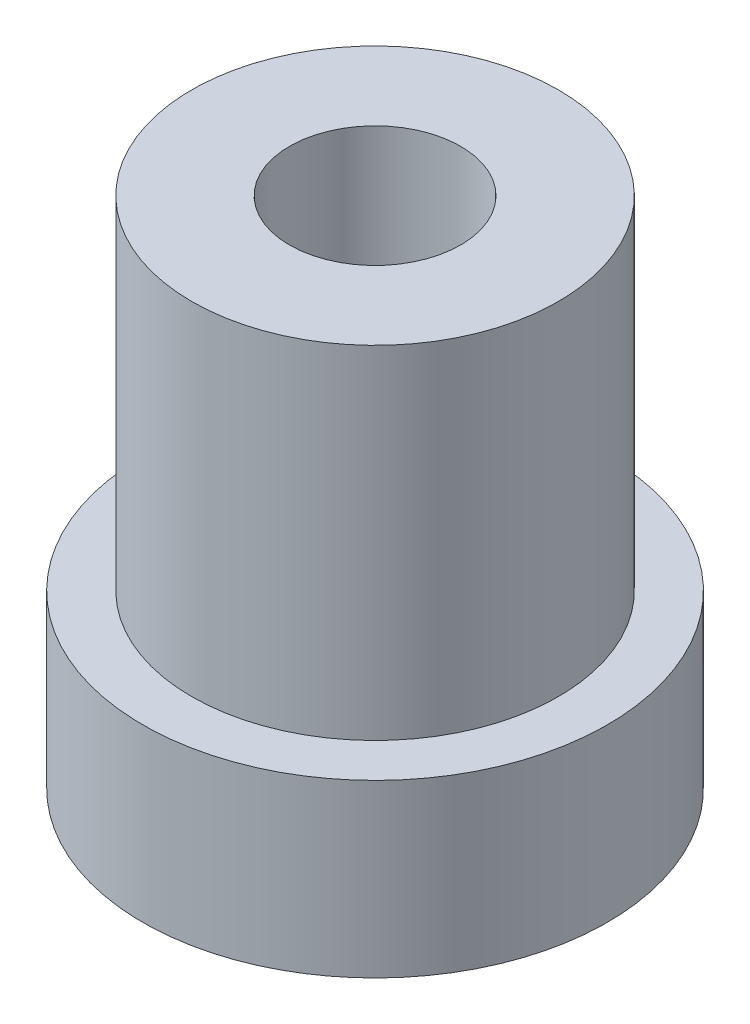
from build123d import *

# Parameters (mm, degrees)
SKETCH1_R                  = 3.75
BOSS_EXTRUDE1_DEPTH        = 10.5
F_3_5_3_5_DIAMETER_HOLE1_D = 3.5
SKETCH5_R                  = 4.75
SKETCH5_R_2                = 3.75
BOSS_EXTRUDE2_DEPTH        = 3.5


with BuildPart() as part:
    # Sketch1 → Boss-Extrude1 (new body)
    with BuildSketch(Plane(origin=(0, 0, 0), x_dir=(1, 0, 0), z_dir=(0, 1, 0))):
        with Locations(Location((0, 0, 0), (0, 0, 90))):
            Circle(SKETCH1_R)
    extrude(amount=BOSS_EXTRUDE1_DEPTH)

    # Ø3.5 (3.5) Diameter Hole1 (through all)
    with Locations(Plane(origin=(0, 10.5, 0), x_dir=(1, 0, 0), z_dir=(0, 1, 0))):
        with Locations((0, 0)):
            Hole(F_3_5_3_5_DIAMETER_HOLE1_D / 2)

    # Sketch5 → Boss-Extrude2 (add)
    with BuildSketch(Plane.XZ):
        with Locations(Location((0, 0, 0), (0, 0, 270))):
            Circle(SKETCH5_R)
        with Locations(Location((0, 0, 0), (0, 0, 270))):
            Circle(SKETCH5_R_2, mode=Mode.SUBTRACT)
    extrude(amount=-BOSS_EXTRUDE2_DEPTH)


solid = part.part
